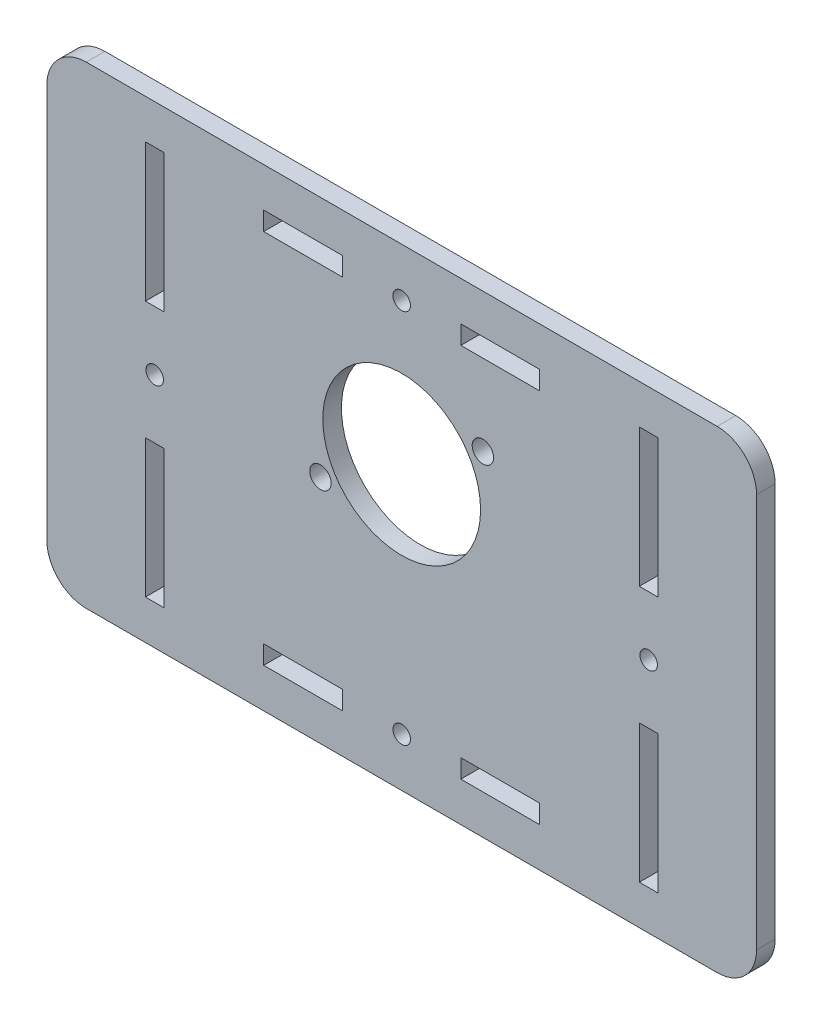
from build123d import *

# Parameters (mm, degrees)
BOSS_EXTRUDE1_DEPTH = 3
CUT_EXTRUDE1_REACH  = 139.404
SKETCH2_W           = 12.7
SKETCH2_H           = 3
SKETCH2_W_2         = 3
SKETCH2_H_2         = 22.225
CUT_EXTRUDE3_REACH  = 139.404
SKETCH4_R           = 1.7272
SKETCH4_R_2         = 12.70635
CUT_EXTRUDE4_REACH  = 139.404
SKETCH5_R           = 1.4097


with BuildPart() as part:
    # Sketch1 → Boss-Extrude1 (new body)
    with BuildSketch(Plane.XY):
        with BuildLine():
            Line((6.35, 0), (107.95, 0))
            ThreePointArc((107.95, 0), (112.440128061, 1.859871939), (114.3, 6.35))
            Line((114.3, 6.35), (114.3, 69.85))
            ThreePointArc((114.3, 69.85), (112.440128061, 74.340128061), (107.95, 76.2))
            Line((107.95, 76.2), (6.35, 76.2))
            ThreePointArc((6.35, 76.2), (1.859871939, 74.340128061), (0, 69.85))
            Line((0, 69.85), (0, 6.35))
            ThreePointArc((0, 6.35), (1.859871939, 1.859871939), (6.35, 0))
        make_face()
    extrude(amount=BOSS_EXTRUDE1_DEPTH)

    # Sketch2 → Cut-Extrude1 (cut, up to next)
    with BuildSketch(Plane(origin=(0, 0, 0), x_dir=(-1, 0, 0), z_dir=(0, 0, -1)), mode=Mode.PRIVATE) as cut_extrude1_sk1:
        with Locations((-73.025, 68.35)):
            Rectangle(SKETCH2_W, SKETCH2_H)
    cut_extrude1_tool1 = extrude(cut_extrude1_sk1.sketch, amount=-CUT_EXTRUDE1_REACH, mode=Mode.PRIVATE) & part.part
    # Sketch2 → Cut-Extrude1 (cut, up to next)
    with BuildSketch(Plane(origin=(0, 0, 0), x_dir=(-1, 0, 0), z_dir=(0, 0, -1)), mode=Mode.PRIVATE) as cut_extrude1_sk2:
        with Locations((-41.275, 68.35)):
            Rectangle(SKETCH2_W, SKETCH2_H)
    cut_extrude1_tool2 = extrude(cut_extrude1_sk2.sketch, amount=-CUT_EXTRUDE1_REACH, mode=Mode.PRIVATE) & part.part
    # Sketch2 → Cut-Extrude1 (cut, up to next)
    with BuildSketch(Plane(origin=(0, 0, 0), x_dir=(-1, 0, 0), z_dir=(0, 0, -1)), mode=Mode.PRIVATE) as cut_extrude1_sk3:
        with Locations((-17.375, 58.7375)):
            Rectangle(SKETCH2_W_2, SKETCH2_H_2)
    cut_extrude1_tool3 = extrude(cut_extrude1_sk3.sketch, amount=-CUT_EXTRUDE1_REACH, mode=Mode.PRIVATE) & part.part
    # Sketch2 → Cut-Extrude1 (cut, up to next)
    with BuildSketch(Plane(origin=(0, 0, 0), x_dir=(-1, 0, 0), z_dir=(0, 0, -1)), mode=Mode.PRIVATE) as cut_extrude1_sk4:
        with Locations((-17.375, 17.4625)):
            Rectangle(SKETCH2_W_2, SKETCH2_H_2)
    cut_extrude1_tool4 = extrude(cut_extrude1_sk4.sketch, amount=-CUT_EXTRUDE1_REACH, mode=Mode.PRIVATE) & part.part
    # Sketch2 → Cut-Extrude1 (cut, up to next)
    with BuildSketch(Plane(origin=(0, 0, 0), x_dir=(-1, 0, 0), z_dir=(0, 0, -1)), mode=Mode.PRIVATE) as cut_extrude1_sk5:
        with Locations((-41.275, 7.85)):
            Rectangle(SKETCH2_W, SKETCH2_H)
    cut_extrude1_tool5 = extrude(cut_extrude1_sk5.sketch, amount=-CUT_EXTRUDE1_REACH, mode=Mode.PRIVATE) & part.part
    # Sketch2 → Cut-Extrude1 (cut, up to next)
    with BuildSketch(Plane(origin=(0, 0, 0), x_dir=(-1, 0, 0), z_dir=(0, 0, -1)), mode=Mode.PRIVATE) as cut_extrude1_sk6:
        with Locations((-73.025, 7.85)):
            Rectangle(SKETCH2_W, SKETCH2_H)
    cut_extrude1_tool6 = extrude(cut_extrude1_sk6.sketch, amount=-CUT_EXTRUDE1_REACH, mode=Mode.PRIVATE) & part.part
    # Sketch2 → Cut-Extrude1 (cut, up to next)
    with BuildSketch(Plane(origin=(0, 0, 0), x_dir=(-1, 0, 0), z_dir=(0, 0, -1)), mode=Mode.PRIVATE) as cut_extrude1_sk7:
        with Locations((-96.925, 17.4625)):
            Rectangle(SKETCH2_W_2, SKETCH2_H_2)
    cut_extrude1_tool7 = extrude(cut_extrude1_sk7.sketch, amount=-CUT_EXTRUDE1_REACH, mode=Mode.PRIVATE) & part.part
    # Sketch2 → Cut-Extrude1 (cut, up to next)
    with BuildSketch(Plane(origin=(0, 0, 0), x_dir=(-1, 0, 0), z_dir=(0, 0, -1)), mode=Mode.PRIVATE) as cut_extrude1_sk8:
        with Locations((-96.925, 58.7375)):
            Rectangle(SKETCH2_W_2, SKETCH2_H_2)
    cut_extrude1_tool8 = extrude(cut_extrude1_sk8.sketch, amount=-CUT_EXTRUDE1_REACH, mode=Mode.PRIVATE) & part.part
    add(cut_extrude1_tool1.solids().sort_by_distance((73.025, 68.35, 0))[0], mode=Mode.SUBTRACT)
    add(cut_extrude1_tool2.solids().sort_by_distance((41.275, 68.35, 0))[0], mode=Mode.SUBTRACT)
    add(cut_extrude1_tool3.solids().sort_by_distance((17.375, 58.7375, 0))[0], mode=Mode.SUBTRACT)
    add(cut_extrude1_tool4.solids().sort_by_distance((17.375, 17.4625, 0))[0], mode=Mode.SUBTRACT)
    add(cut_extrude1_tool5.solids().sort_by_distance((41.275, 7.85, 0))[0], mode=Mode.SUBTRACT)
    add(cut_extrude1_tool6.solids().sort_by_distance((73.025, 7.85, 0))[0], mode=Mode.SUBTRACT)
    add(cut_extrude1_tool7.solids().sort_by_distance((96.925, 17.4625, 0))[0], mode=Mode.SUBTRACT)
    add(cut_extrude1_tool8.solids().sort_by_distance((96.925, 58.7375, 0))[0], mode=Mode.SUBTRACT)

    # Sketch4 → Cut-Extrude3 (cut, up to next)
    with BuildSketch(Plane.XY.offset(3), mode=Mode.PRIVATE) as cut_extrude3_sk1:
        with Locations((70.231, 53.822979832)):
            Circle(SKETCH4_R)
    cut_extrude3_tool1 = extrude(cut_extrude3_sk1.sketch, amount=-CUT_EXTRUDE3_REACH, mode=Mode.PRIVATE) & part.part
    # Sketch4 → Cut-Extrude3 (cut, up to next)
    with BuildSketch(Plane.XY.offset(3), mode=Mode.PRIVATE) as cut_extrude3_sk2:
        with Locations((44.069, 37.160579832)):
            Circle(SKETCH4_R)
    cut_extrude3_tool2 = extrude(cut_extrude3_sk2.sketch, amount=-CUT_EXTRUDE3_REACH, mode=Mode.PRIVATE) & part.part
    # Sketch4 → Cut-Extrude3 (cut, up to next)
    with BuildSketch(Plane.XY.offset(3), mode=Mode.PRIVATE) as cut_extrude3_sk3:
        with Locations((57.15, 45.491779832)):
            Circle(SKETCH4_R_2)
    cut_extrude3_tool3 = extrude(cut_extrude3_sk3.sketch, amount=-CUT_EXTRUDE3_REACH, mode=Mode.PRIVATE) & part.part
    add(cut_extrude3_tool1.solids().sort_by_distance((70.231, 53.82298, 3))[0], mode=Mode.SUBTRACT)
    add(cut_extrude3_tool2.solids().sort_by_distance((44.069, 37.16058, 3))[0], mode=Mode.SUBTRACT)
    add(cut_extrude3_tool3.solids().sort_by_distance((57.15, 45.49178, 3))[0], mode=Mode.SUBTRACT)

    # Sketch5 → Cut-Extrude4 (cut, up to next)
    with BuildSketch(Plane.XY.offset(3), mode=Mode.PRIVATE) as cut_extrude4_sk1:
        with Locations((57.15, 68.35)):
            Circle(SKETCH5_R)
    cut_extrude4_tool1 = extrude(cut_extrude4_sk1.sketch, amount=-CUT_EXTRUDE4_REACH, mode=Mode.PRIVATE) & part.part
    # Sketch5 → Cut-Extrude4 (cut, up to next)
    with BuildSketch(Plane.XY.offset(3), mode=Mode.PRIVATE) as cut_extrude4_sk2:
        with Locations((96.925, 38.1)):
            Circle(SKETCH5_R)
    cut_extrude4_tool2 = extrude(cut_extrude4_sk2.sketch, amount=-CUT_EXTRUDE4_REACH, mode=Mode.PRIVATE) & part.part
    # Sketch5 → Cut-Extrude4 (cut, up to next)
    with BuildSketch(Plane.XY.offset(3), mode=Mode.PRIVATE) as cut_extrude4_sk3:
        with Locations((57.15, 7.85)):
            Circle(SKETCH5_R)
    cut_extrude4_tool3 = extrude(cut_extrude4_sk3.sketch, amount=-CUT_EXTRUDE4_REACH, mode=Mode.PRIVATE) & part.part
    # Sketch5 → Cut-Extrude4 (cut, up to next)
    with BuildSketch(Plane.XY.offset(3), mode=Mode.PRIVATE) as cut_extrude4_sk4:
        with Locations((17.375, 38.1)):
            Circle(SKETCH5_R)
    cut_extrude4_tool4 = extrude(cut_extrude4_sk4.sketch, amount=-CUT_EXTRUDE4_REACH, mode=Mode.PRIVATE) & part.part
    add(cut_extrude4_tool1.solids().sort_by_distance((57.15, 68.35, 3))[0], mode=Mode.SUBTRACT)
    add(cut_extrude4_tool2.solids().sort_by_distance((96.925, 38.1, 3))[0], mode=Mode.SUBTRACT)
    add(cut_extrude4_tool3.solids().sort_by_distance((57.15, 7.85, 3))[0], mode=Mode.SUBTRACT)
    add(cut_extrude4_tool4.solids().sort_by_distance((17.375, 38.1, 3))[0], mode=Mode.SUBTRACT)


solid = part.part
